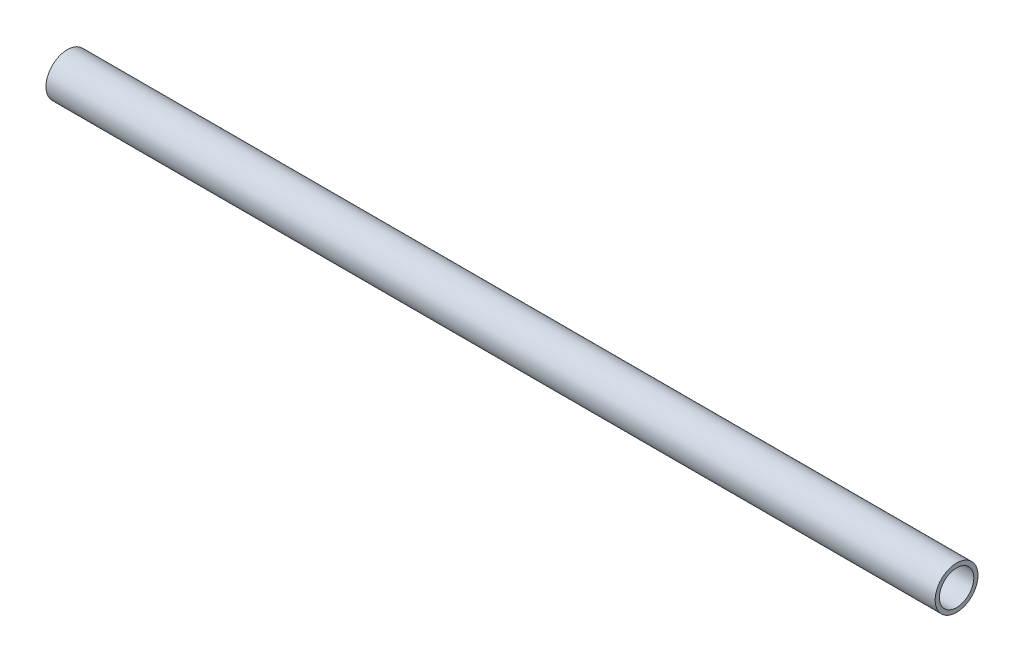
from build123d import *

# Parameters (mm, degrees)
SKIZZE1_R                       = 2.55
SKIZZE1_R_2                     = 2.05
AUFSATZ_LINEAR_AUSTRAGEN1_DEPTH = 52.95


with BuildPart() as part:
    # Skizze1 → Aufsatz-Linear austragen1 (new, symmetric)
    with BuildSketch(Plane(origin=(0, 0, 0), x_dir=(0, 0, -1), z_dir=(1, 0, 0))):
        Circle(SKIZZE1_R)
        Circle(SKIZZE1_R_2, mode=Mode.SUBTRACT)
    extrude(amount=AUFSATZ_LINEAR_AUSTRAGEN1_DEPTH, both=True)


solid = part.part
